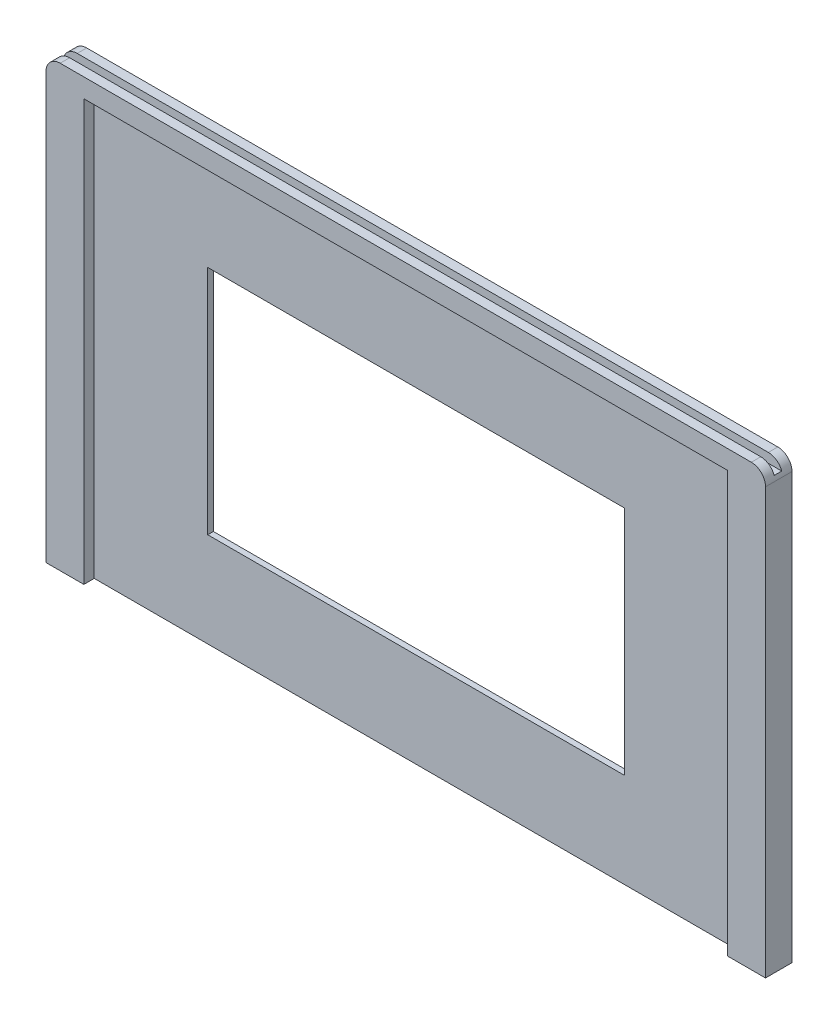
from build123d import *

# Parameters (mm, degrees)
EXTRUDE_1_DEPTH     = 7
CUT_EXTRUDE_1_DEPTH = 2.75
CUT_EXTRUDE_2_DEPTH = 2.75
SKETCH_4_W          = 190.2
SKETCH_4_H          = 2
CUT_EXTRUDE_3_DEPTH = 2.5
SKETCH_5_W          = 110.2
SKETCH_5_H          = 61.2
CUT_EXTRUDE_4_DEPTH = 118.847914448


with BuildPart() as part:
    # 草图1 → 凸台-拉伸1 (new body)
    with BuildSketch(Plane.XY):
        with BuildLine():
            Line((-91.35, 69.469838346), (91.35, 69.469838346))
            ThreePointArc((91.35, 69.469838346), (94.001650429, 68.371488775), (95.1, 65.719838346))
            Line((95.1, 65.719838346), (95.1, -46.730161654))
            Line((95.1, -46.730161654), (-95.1, -46.730161654))
            Line((-95.1, -46.730161654), (-95.1, 65.719838346))
            ThreePointArc((-95.1, 65.719838346), (-94.001650429, 68.371488775), (-91.35, 69.469838346))
        make_face()
    extrude(amount=EXTRUDE_1_DEPTH)

    # 草图2 → 切除-拉伸1 (cut)
    with BuildSketch(Plane.XY):
        Polygon((-85.1, -46.730161654), (85.1, -46.730161654), (85.1, -36.730161654), (85.1, 59.469838346), (85.1, 64.469838346), (-85.1, 64.469838346), (-85.1, 59.469838346), (-85.1, -36.730161654), align=None)
    extrude(amount=CUT_EXTRUDE_1_DEPTH, mode=Mode.SUBTRACT)

    # 草图3 → 切除-拉伸2 (cut)
    with BuildSketch(Plane.XY.offset(7)):
        Polygon((-85.1, -36.730161654), (-85.1, -46.730161654), (85.1, -46.730161654), (85.1, -36.730161654), (85.1, 59.469838346), (85.1, 64.469838346), (-85.1, 64.469838346), (-85.1, 59.469838346), align=None)
    extrude(amount=-CUT_EXTRUDE_2_DEPTH, mode=Mode.SUBTRACT)

    # 草图4 → 切除-拉伸3 (cut)
    with BuildSketch(Plane(origin=(0, 69.469838346, 0), x_dir=(1, 0, 0), z_dir=(0, 1, 0))):
        with Locations((0, -3.5)):
            Rectangle(SKETCH_4_W, SKETCH_4_H)
    extrude(amount=-CUT_EXTRUDE_3_DEPTH, mode=Mode.SUBTRACT)

    # 草图5 → 切除-拉伸4 (cut, through all)
    with BuildSketch(Plane.XY.offset(4.25)):
        with Locations((0, 8.869838346)):
            Rectangle(SKETCH_5_W, SKETCH_5_H)
    extrude(amount=-CUT_EXTRUDE_4_DEPTH, mode=Mode.SUBTRACT)


solid = part.part
